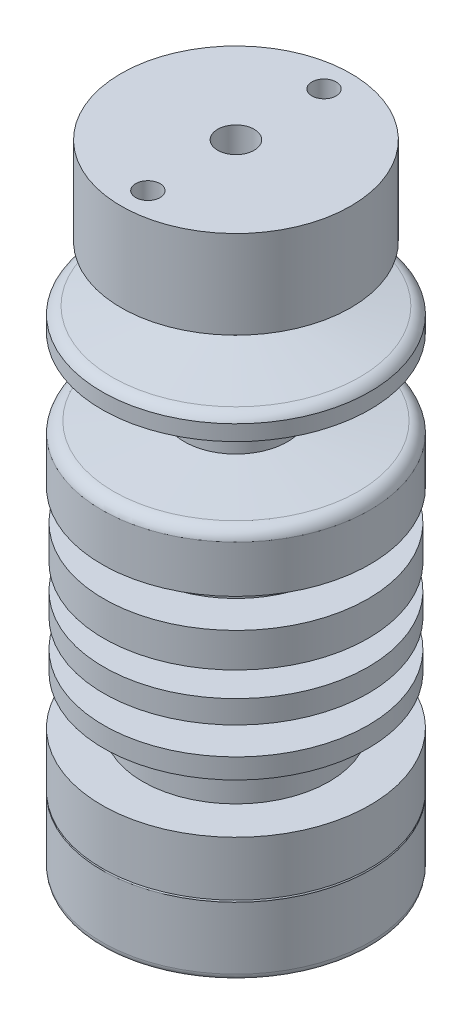
from build123d import *

# Parameters (mm, degrees)
CORTAR_EXTRUIR3_DEPTH      = 8
CORTAR_EXTRUIR3_DEPTH_BACK = 27
CROQUIS5_R                 = 7.9375
CROQUIS9_R                 = 3.175
CORTAR_EXTRUIR5_DEPTH      = 18
CROQUIS10_R                = 4.765
CORTAR_EXTRUIR6_DEPTH      = 35
CROQUIS11_R                = 35
SALIENTE_EXTRUIR1_DEPTH    = 14.24
CROQUIS13_R                = 8.035449209
CORTAR_EXTRUIR8_DEPTH      = 30.21


with BuildPart() as part:
    # Croquis1 → Revolución3 (revolve)
    with BuildSketch(Plane.XY, mode=Mode.PRIVATE) as revoluci_n3_sk:
        with BuildLine():
            Line((0, 43.044568245), (30, 43.044568245))
            Line((30, 43.044568245), (30, 20.044568245))
            Line((30, 20.044568245), (12.985796912, 20.044568245))
            Line((12.985796912, 20.044568245), (12.985796912, 10.406207601))
            ThreePointArc((12.985796912, 10.406207601), (13.175212613, 9.391052882), (13.717969076, 8.512512712))
            Line((13.717969076, 8.512512712), (32.309744815, 5.485961945))
            ThreePointArc((32.309744815, 5.485961945), (33.884795273, 4.831882369), (35, 3.541563627))
            Line((35, 3.541563627), (35, -0.490098714))
            Line((35, -0.490098714), (13.468735488, -0.490098714))
            Line((13.468735488, -0.490098714), (13.468735488, -18.538757946))
            Line((13.468735488, -18.538757946), (31.979226627, -20.513196287))
            ThreePointArc((31.979226627, -20.513196287), (33.927671218, -21.380602851), (35, -23.224224681))
            Line((35, -23.224224681), (35, -35.501069654))
            Line((35, -35.501069654), (24.334695592, -35.501069654))
            Line((24.334695592, -35.501069654), (24.334695592, -43.520130292))
            Line((24.334695592, -43.520130292), (34.538342083, -43.520130292))
            Line((34.538342083, -43.520130292), (34.538342083, -52.477142798))
            Line((34.538342083, -52.477142798), (24.334695592, -52.477142798))
            Line((24.334695592, -52.477142798), (24.334695592, -58.946096275))
            Line((24.334695592, -58.946096275), (34.538342083, -58.946096275))
            Line((34.538342083, -58.946096275), (34.538342083, -64.917437946))
            Line((34.538342083, -64.917437946), (24.334695592, -64.917437946))
            Line((24.334695592, -64.917437946), (24.334695592, -72.132809132))
            Line((24.334695592, -72.132809132), (34.538342083, -72.132809132))
            Line((34.538342083, -72.132809132), (34.538342083, -77.357733094))
            Line((34.538342083, -77.357733094), (24.334695592, -77.357733094))
            Line((24.334695592, -77.357733094), (24.334695592, -104.221668074))
            Line((24.334695592, -104.221668074), (34.538342083, -104.221668074))
            ThreePointArc((34.538342083, -104.221668074), (34.864783527, -104.356884547), (35, -104.683325991))
            Line((35, -104.683325991), (35, -120.950877143))
            ThreePointArc((35, -120.950877143), (34.933442046, -121.487214162), (34.737806004, -121.991013624))
            Line((34.737806004, -121.991013624), (0, -121.955431755))
            Line((0, -121.955431755), (0, 43.044568245))
        make_face()
    revolve(revoluci_n3_sk.sketch.rotate(Axis((0, 43.044568245, 0), (0, -1, 0)), 180), axis=Axis((0, 43.044568245, 0), (0, -1, 0)))

    # Croquis5 → Cortar-Extruir3 (cut, two sides: drawn at the far end of the back side and taken through both)
    with BuildSketch(Plane(origin=(0, -104.221668074, 0), x_dir=(1, 0, 0), z_dir=(0, 1, 0)).offset(-CORTAR_EXTRUIR3_DEPTH_BACK)):
        with Locations(Location((0.097949209, 0, 0), (0, 0, 270))):
            Circle(CROQUIS5_R)
    extrude(amount=CORTAR_EXTRUIR3_DEPTH + CORTAR_EXTRUIR3_DEPTH_BACK, mode=Mode.SUBTRACT)

    # Croquis9 → Cortar-Extruir5 (cut)
    with BuildSketch(Plane(origin=(0, 43.044568245, 0), x_dir=(1, 0, 0), z_dir=(0, 1, 0))):
        with Locations(Location((0, 23, 0), (0, 0, 180))):
            Circle(CROQUIS9_R)
        with Locations(Location((0, -23, 0), (0, 0, 180))):
            Circle(CROQUIS9_R)
    extrude(amount=-CORTAR_EXTRUIR5_DEPTH, mode=Mode.SUBTRACT)

    # Croquis10 → Cortar-Extruir6 (cut)
    with BuildSketch(Plane(origin=(0, 43.044568245, 0), x_dir=(1, 0, 0), z_dir=(0, 1, 0))):
        with Locations(Location((0, 0, 0), (0, 0, 180))):
            Circle(CROQUIS10_R)
    extrude(amount=-CORTAR_EXTRUIR6_DEPTH, mode=Mode.SUBTRACT)

    # Croquis11 → Saliente-Extruir1 (add)
    with BuildSketch(Plane(origin=(0, -104.221668074, 0), x_dir=(1, 0, 0), z_dir=(0, 1, 0))):
        with Locations(Location((0, 0, 0), (0, 0, 180))):
            Circle(CROQUIS11_R)
    extrude(amount=SALIENTE_EXTRUIR1_DEPTH)

    # Croquis13 → Cortar-Extruir8 (cut)
    with BuildSketch(Plane.XZ.offset(104.221668074)):
        Circle(CROQUIS13_R)
    extrude(amount=-CORTAR_EXTRUIR8_DEPTH, mode=Mode.SUBTRACT)


solid = part.part
